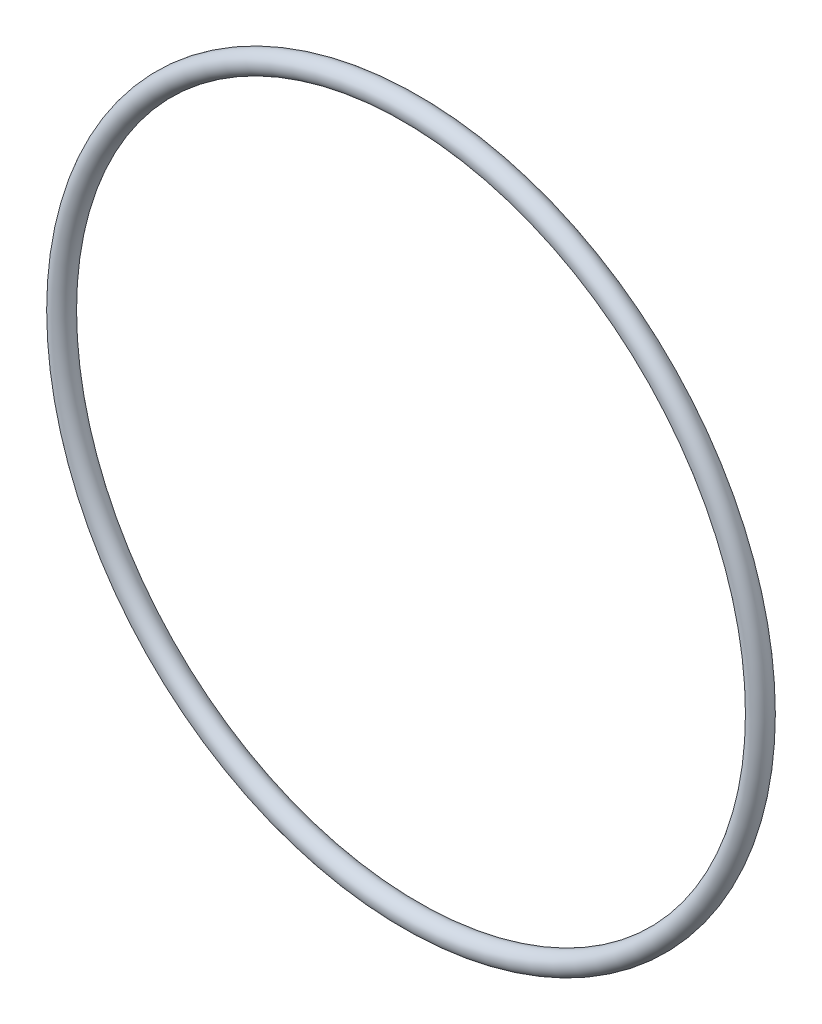
from build123d import *

# Parameters (mm, degrees)
SKETCH1_R = 2.667


with BuildPart() as part:
    # Sketch1 → Revolve1 (revolve)
    with BuildSketch(Plane(origin=(0, 0, 0), x_dir=(0, -1, 0), z_dir=(1, 0, 0)), mode=Mode.PRIVATE) as revolve1_sk:
        with Locations((88.0745, 0)):
            Circle(SKETCH1_R)
    revolve(revolve1_sk.sketch.rotate(Axis((0, 0, 2.667), (0, 0, -1)), 270), axis=Axis((0, 0, 2.667), (0, 0, -1)))


solid = part.part
